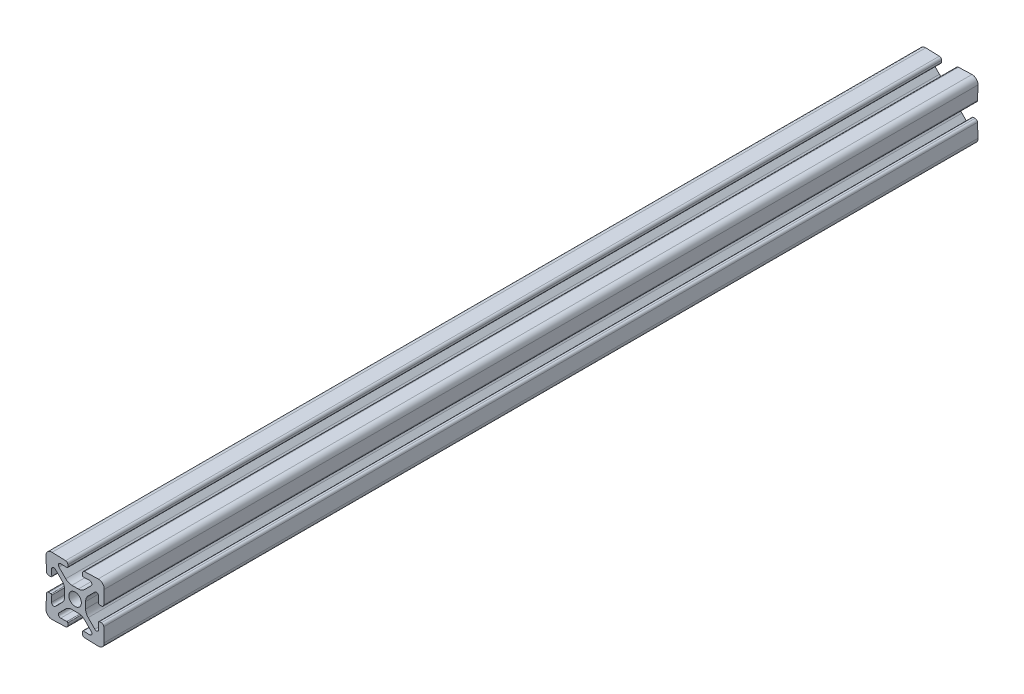
from build123d import *

# Parameters (mm, degrees)
BOSS_EXTRUDE1_DEPTH = 150
CIRPATTERN1_COUNT   = 4


with BuildPart() as part:
    # Sketch3 → Boss-Extrude1 (new, symmetric)
    with BuildSketch(Plane.XY):
        with BuildLine():
            Line((-2.524916986, 8.30911066), (-2.500487338, 9.008684239))
            ThreePointArc((-2.500487338, 9.008684239), (-2.714917039, 9.582202525), (-3.272080403, 9.836116498))
            Line((-3.272080403, 9.836116498), (-7.930201007, 9.998781654))
            ThreePointArc((-7.930201007, 9.998781654), (-9.414213562, 9.414213562), (-9.998781654, 7.930201007))
            Line((-9.998781654, 7.930201007), (-9.836116498, 3.272080403))
            ThreePointArc((-9.836116498, 3.272080403), (-9.582202525, 2.714917039), (-9.008684239, 2.500487338))
            Line((-9.008684239, 2.500487338), (-8.30911066, 2.524916986))
            ThreePointArc((-8.30911066, 2.524916986), (-8.100174399, 2.620134726), (-8.019763261, 2.835204083))
            Line((-8.019763261, 2.835204083), (-8.093719461, 4.953032548))
            ThreePointArc((-8.093719461, 4.953032548), (-7.631170264, 5.686128657), (-6.779559917, 5.52444538))
            Line((-6.779559917, 5.52444538), (-4.478679656, 3.22356512))
            ThreePointArc((-4.478679656, 3.22356512), (-3.828361402, 2.250295073), (-3.6, 1.102244776))
            Line((-3.6, 1.102244776), (-3.6, 0))
            Line((-3.6, 0), (-2.15, 0))
            ThreePointArc((-2.15, 0), (-1.52027958, 1.52027958), (0, 2.15))
            Line((0, 2.15), (0, 3.6))
            Line((0, 3.6), (-1.102244776, 3.6))
            ThreePointArc((-1.102244776, 3.6), (-2.250295073, 3.828361402), (-3.22356512, 4.478679656))
            Line((-3.22356512, 4.478679656), (-5.52444538, 6.779559917))
            ThreePointArc((-5.52444538, 6.779559917), (-5.686128657, 7.631170264), (-4.953032548, 8.093719461))
            Line((-4.953032548, 8.093719461), (-2.835204083, 8.019763261))
            ThreePointArc((-2.835204083, 8.019763261), (-2.620134726, 8.100174399), (-2.524916986, 8.30911066))
        make_face()
    extrude(amount=BOSS_EXTRUDE1_DEPTH, both=True)


with BuildPart() as cirpattern1_1:
    # CirPattern1: pattern copy
    add(part.part.rotate(Axis((0, 0, 150), (0, 0, -1)), 1 * 360 / CIRPATTERN1_COUNT))


with BuildPart() as cirpattern1_2:
    # CirPattern1: pattern copy
    add(part.part.rotate(Axis((0, 0, 150), (0, 0, -1)), 2 * 360 / CIRPATTERN1_COUNT))


with BuildPart() as cirpattern1_3:
    # CirPattern1: pattern copy
    add(part.part.rotate(Axis((0, 0, 150), (0, 0, -1)), 3 * 360 / CIRPATTERN1_COUNT))


with BuildPart() as cirpattern1_1_1:
    add(cirpattern1_1.part)

    # Combine1: union CirPattern1_2, CirPattern1_3, part
    add(cirpattern1_2.part)
    add(cirpattern1_3.part)
    add(part.part)


solid = cirpattern1_1_1.part
